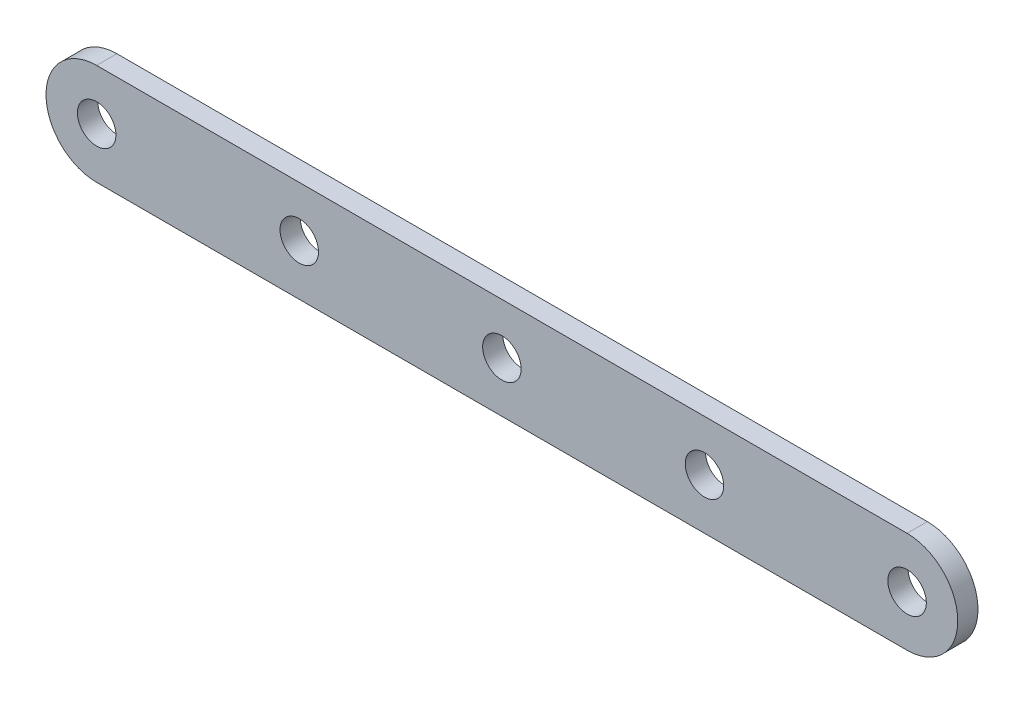
from build123d import *

# Parameters (mm, degrees)
BOSS_EXTRUDE1_DEPTH = 1.27
SKETCH2_R           = 2.413
CUT_EXTRUDE1_DEPTH  = 58.557767504
LPATTERN1_COUNT     = 5
LPATTERN1_PITCH     = 25.4


with BuildPart() as part:
    # Sketch1 → Boss-Extrude1 (new, symmetric)
    with BuildSketch(Plane.XY):
        with BuildLine():
            Line((-50.8, 6.35), (50.8, 6.35))
            ThreePointArc((50.8, 6.35), (57.15, 0), (50.8, -6.35))
            Line((50.8, -6.35), (-50.8, -6.35))
            ThreePointArc((-50.8, -6.35), (-57.15, 0), (-50.8, 6.35))
        make_face()
    extrude(amount=BOSS_EXTRUDE1_DEPTH, both=True)

    # Sketch2 → Cut-Extrude1 (cut, through all)
    with BuildSketch(Plane.XY.offset(1.27)):
        with Locations((-50.8, 0)):
            Circle(SKETCH2_R)
    cut_extrude1 = extrude(amount=-CUT_EXTRUDE1_DEPTH, mode=Mode.SUBTRACT)

    # LPattern1: Cut-Extrude1 ×5
    with Locations(*[(i * LPATTERN1_PITCH, 0, 0) for i in range(1, LPATTERN1_COUNT)]):
        add(cut_extrude1, mode=Mode.SUBTRACT)


solid = part.part
